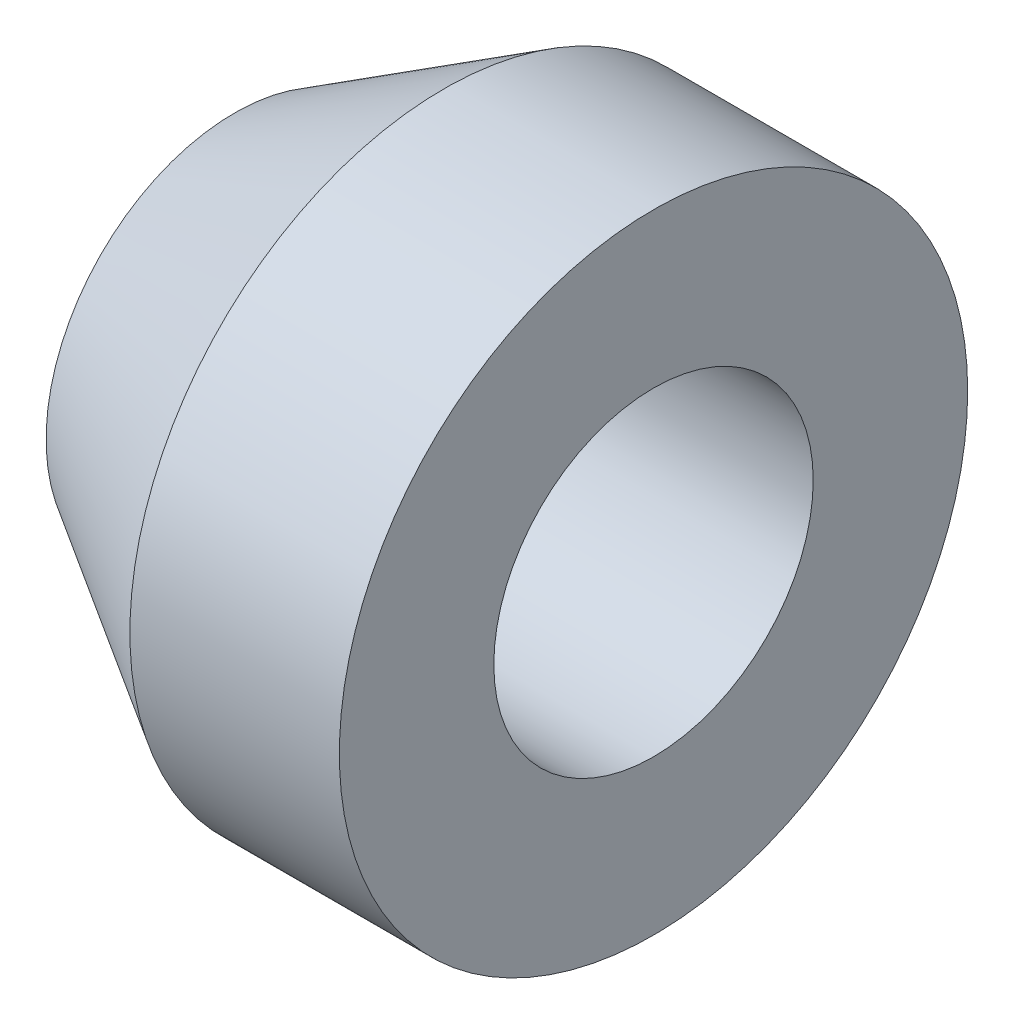
from build123d import *

# Parameters (mm, degrees)
SKETCH1_R           = 3
SKETCH1_R_2         = 1.525
BOSS_EXTRUDE1_DEPTH = 4
CHAMFER1_SIZE       = 1.2
CHAMFER1_SIZE2      = 2


with BuildPart() as part:
    # Sketch1 → Boss-Extrude1 (new body)
    with BuildSketch(Plane(origin=(0, 0, 0), x_dir=(0, 0, -1), z_dir=(1, 0, 0))):
        Circle(SKETCH1_R)
        Circle(SKETCH1_R_2, mode=Mode.SUBTRACT)
    extrude(amount=BOSS_EXTRUDE1_DEPTH)

    # Chamfer1
    chamfer1_edges = [part.edges().sort_by_distance(p)[0] for p in [
        (0, 0, 3),
    ]]
    chamfer1_side = [part.faces().sort_by_distance(p)[0] for p in [
        (0, 0, 2.915147186),
    ]]
    chamfer(chamfer1_edges, length=CHAMFER1_SIZE, length2=CHAMFER1_SIZE2, reference=chamfer1_side[0])


solid = part.part
